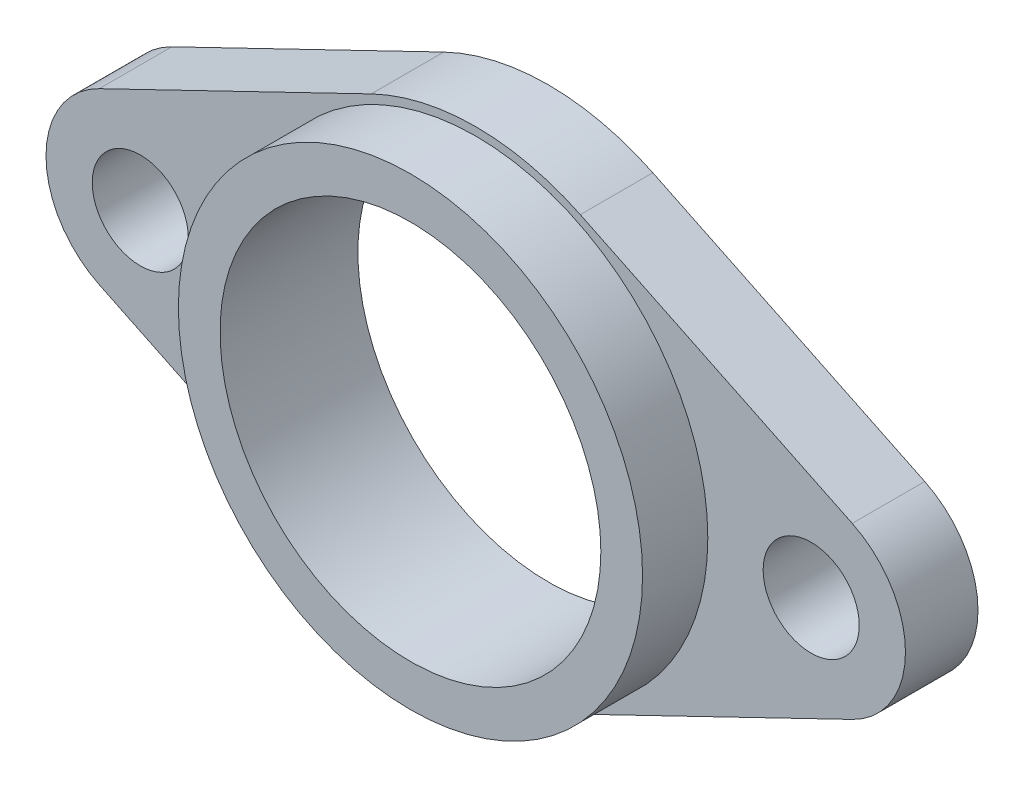
from build123d import *

# Parameters (mm, degrees)
BASE_SKETCH_R                     = 10.5
BASE_EXTRUDE_DEPTH                = 4
BEARING_RETAINING_RING_SKETCH_R   = 12.8
BEARING_RETAINING_RING_SKETCH_R_2 = 10.5
BEARING_RETAINING_RING_DEPTH      = 7.6
MOUNTING_HOLES_D                  = 5.3


with BuildPart() as part:
    # Base Sketch → Base Extrude (new body)
    with BuildSketch(Plane.XY):
        with BuildLine():
            Line((-20.762702703, 4.681898811), (-5.765540541, 11.929838317))
            ThreePointArc((-5.765540541, 11.929838317), (0, 13.25), (5.765540541, 11.929838317))
            Line((5.765540541, 11.929838317), (20.762702703, 4.681898811))
            ThreePointArc((20.762702703, 4.681898811), (23.7, 0), (20.762702703, -4.681898811))
            Line((20.762702703, -4.681898811), (5.765540541, -11.929838317))
            ThreePointArc((5.765540541, -11.929838317), (0, -13.25), (-5.765540541, -11.929838317))
            Line((-5.765540541, -11.929838317), (-20.762702703, -4.681898811))
            ThreePointArc((-20.762702703, -4.681898811), (-23.7, 0), (-20.762702703, 4.681898811))
        make_face()
        Circle(BASE_SKETCH_R, mode=Mode.SUBTRACT)
    extrude(amount=BASE_EXTRUDE_DEPTH)

    # Bearing Retaining Ring Sketch → Bearing Retaining Ring (add)
    with BuildSketch(Plane.XY):
        with Locations(Location((0, 0, 0), (0, 0, 180))):
            Circle(BEARING_RETAINING_RING_SKETCH_R)
        Circle(BEARING_RETAINING_RING_SKETCH_R_2, mode=Mode.SUBTRACT)
    extrude(amount=BEARING_RETAINING_RING_DEPTH)

    # Mounting Holes (through all)
    with Locations(Plane(origin=(0, 0, 0), x_dir=(-1, 0, 0), z_dir=(0, 0, -1))):
        with Locations((18.5, 0), (-18.5, 0)):
            Hole(MOUNTING_HOLES_D / 2)


solid = part.part
